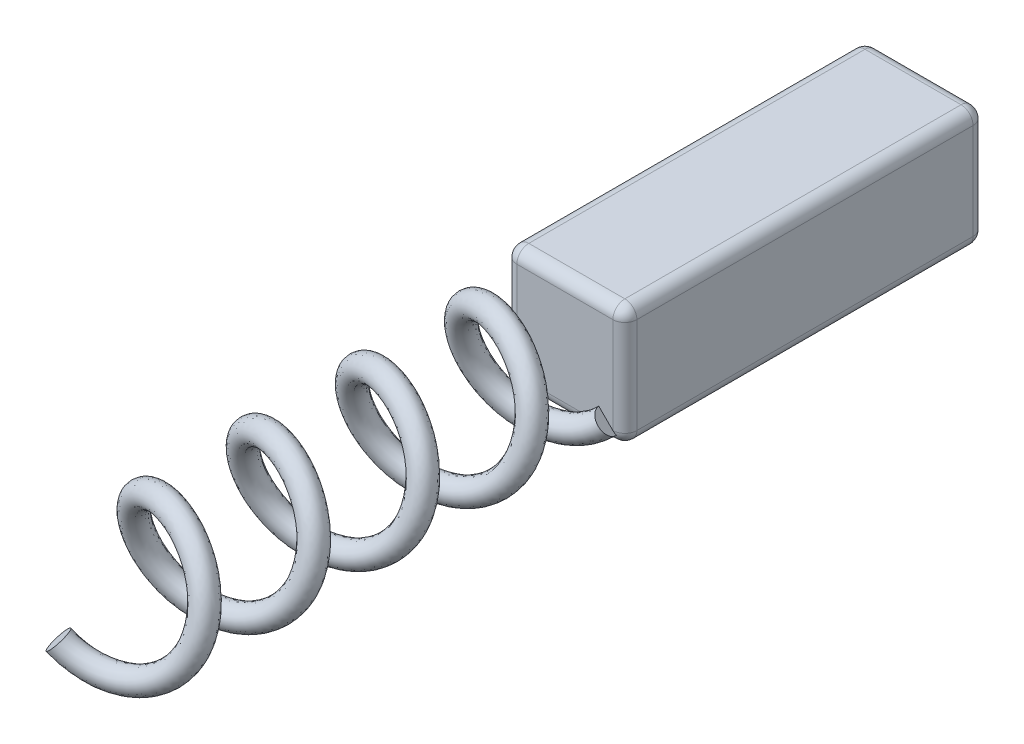
from build123d import *

# Parameters (mm, degrees)
SKETCH1_W           = 5
SKETCH1_H           = 5
BOSS_EXTRUDE1_DEPTH = 15
FILLET1_R           = 0.5
SWEEP1_PITCH        = 4.545454545
SWEEP1_HEIGHT       = 19.318181818
SWEEP1_RADIUS       = 2.5
SWEEP1_START_ANGLE  = -45
SWEEP1_PROFILE_R    = 0.5


with BuildPart() as part:
    # Sketch1 → Boss-Extrude1 (new body)
    with BuildSketch(Plane.XY):
        Rectangle(SKETCH1_W, SKETCH1_H)
    extrude(amount=BOSS_EXTRUDE1_DEPTH)

    # Fillet1
    fillet1_edges = [part.edges().sort_by_distance(p)[0] for p in [
        (2.5, 0, 15),
        (0, 2.5, 15),
        (-2.5, 0, 15),
        (0, 2.5, 0),
        (2.5, 0, 0),
        (0, -2.5, 0),
        (-2.5, 0, 0),
        (0, -2.5, 15),
        (-2.5, 2.5, 7.5),
        (2.5, 2.5, 7.5),
        (2.5, -2.5, 7.5),
        (-2.5, -2.5, 7.5),
    ]]
    fillet(fillet1_edges, radius=FILLET1_R)

    # Sweep1: sweep along a helix
    with BuildLine() as sweep1_path:
        add(Helix(SWEEP1_PITCH, SWEEP1_HEIGHT, SWEEP1_RADIUS, center=(0, 0, 15), direction=(0, 0, 1), lefthand=True, mode=Mode.PRIVATE).rotate(Axis((0, 0, 15), (0, 0, 1)), SWEEP1_START_ANGLE))
    # Sweep1 profile (on start of the path) → Sweep1 (sweep)
    with BuildSketch(Plane(origin=(1.767766953, -1.767766953, 15), x_dir=(-0.7071067811867117, 0.7071067811863837, 0), z_dir=(-0.6792398365554757, -0.6792398365557908, 0.27796850338078505))):
        Circle(SWEEP1_PROFILE_R)
    sweep(path=sweep1_path.line, is_frenet=True)


solid = part.part
